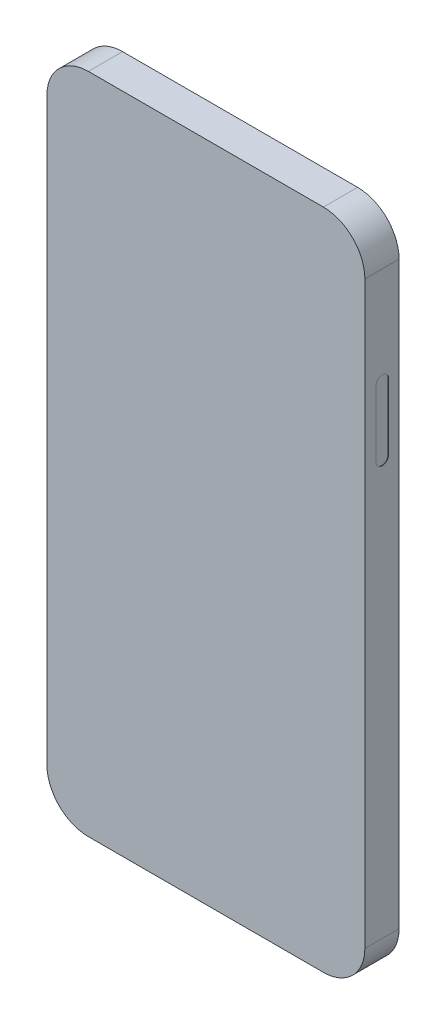
from build123d import *

# Parameters (mm, degrees)
EXTRUDE_1_DEPTH     = 8.25
CUT_EXTRUDE_1_DEPTH = 5
SKETCH_4_R          = 0.5
SKETCH_4_R_2        = 0.517195783
CUT_EXTRUDE_2_DEPTH = 5
CUT_EXTRUDE_3_DEPTH = 0.1
SKETCH_6_R          = 0.157252924
CUT_EXTRUDE_4_DEPTH = 0.1
CUT_EXTRUDE_5_DEPTH = 0.1
CUT_EXTRUDE_6_DEPTH = 0.1
CUT_EXTRUDE_7_DEPTH = 10


with BuildPart() as part:
    # 草图1 → 凸台-拉伸1 (new body)
    with BuildSketch(Plane.XY):
        with BuildLine():
            Line((-18.031435036, 37.379055707), (38.668564964, 37.379055707))
            ThreePointArc((38.668564964, 37.379055707), (45.739632776, 34.450123519), (48.668564964, 27.379055707))
            Line((48.668564964, 27.379055707), (48.668564964, -112.520944293))
            ThreePointArc((48.668564964, -112.520944293), (45.739632776, -119.592012105), (38.668564964, -122.520944293))
            Line((38.668564964, -122.520944293), (-18.031435036, -122.520944293))
            ThreePointArc((-18.031435036, -122.520944293), (-25.102502847, -119.592012105), (-28.031435036, -112.520944293))
            Line((-28.031435036, -112.520944293), (-28.031435036, 27.379055707))
            ThreePointArc((-28.031435036, 27.379055707), (-25.102502847, 34.450123519), (-18.031435036, 37.379055707))
        make_face()
    extrude(amount=EXTRUDE_1_DEPTH)

    # 草图2 → 切除-拉伸1 (cut)
    with BuildSketch(Plane.XZ.offset(122.520944293)):
        with BuildLine():
            Line((6.427510461, 6.234889493), (14.427510461, 6.234889493))
            ThreePointArc((14.427510461, 6.234889493), (15.927510461, 4.734889493), (14.427510461, 3.234889493))
            Line((14.427510461, 3.234889493), (6.427510461, 3.234889493))
            ThreePointArc((6.427510461, 3.234889493), (4.927510461, 4.734889493), (6.427510461, 6.234889493))
        make_face()
    extrude(amount=-CUT_EXTRUDE_1_DEPTH, mode=Mode.SUBTRACT)

    # 草图4 → 切除-拉伸2 (cut)
    with BuildSketch(Plane.XZ.offset(122.520944293)):
        with Locations(Location((2, 4.719775151, 0), (0, 0, 270))):
            Circle(SKETCH_4_R)
        with Locations(Location((0, 4.71977515, 0), (0, 0, 270))):
            Circle(SKETCH_4_R)
        with Locations(Location((-2, 4.71977515, 0), (0, 0, 270))):
            Circle(SKETCH_4_R)
        with Locations(Location((-4, 4.71977515, 0), (0, 0, 270))):
            Circle(SKETCH_4_R)
        with Locations(Location((18, 4.71977515, 0), (0, 0, 270))):
            Circle(SKETCH_4_R_2)
        with Locations(Location((20, 4.71977515, 0), (0, 0, 270))):
            Circle(SKETCH_4_R)
        with Locations(Location((22, 4.71977515, 0), (0, 0, 270))):
            Circle(SKETCH_4_R)
        with Locations(Location((24, 4.71977515, 0), (0, 0, 270))):
            Circle(SKETCH_4_R)
        with Locations(Location((26, 4.71977515, 0), (0, 0, 270))):
            Circle(SKETCH_4_R)
        with Locations(Location((28, 4.71977515, 0), (0, 0, 270))):
            Circle(SKETCH_4_R)
    extrude(amount=-CUT_EXTRUDE_2_DEPTH, mode=Mode.SUBTRACT)

    # 草图5 → 切除-拉伸3 (cut)
    with BuildSketch(Plane(origin=(48.668564964, 0, 0), x_dir=(0, 0, -1), z_dir=(1, 0, 0))):
        with BuildLine():
            Line((-2.555232712, 3.731296592), (-2.555232712, -12.268703408))
            ThreePointArc((-2.555232712, -12.268703408), (-4.055232712, -13.768703408), (-5.555232712, -12.268703408))
            Line((-5.555232712, -12.268703408), (-5.555232712, 3.731296592))
            ThreePointArc((-5.555232712, 3.731296592), (-4.055232712, 5.231296592), (-2.555232712, 3.731296592))
        make_face()
    extrude(amount=-CUT_EXTRUDE_3_DEPTH, mode=Mode.SUBTRACT)

    # 草图6 → 切除-拉伸4 (cut)
    with BuildSketch(Plane.ZY.offset(28.031435036)):
        with Locations(Location((4.361987168, 13.879950774, 0), (0, 0, 270))):
            Circle(SKETCH_6_R)
        with BuildLine():
            Line((5.5, -11.5), (5.5, -22.5))
            ThreePointArc((5.5, -22.5), (4, -24), (2.5, -22.5))
            Line((2.5, -22.5), (2.5, -11.5))
            ThreePointArc((2.5, -11.5), (4, -10), (5.5, -11.5))
        make_face()
        with BuildLine():
            Line((5.5, 5.5), (5.5, -5.5))
            ThreePointArc((5.5, -5.5), (4, -7), (2.5, -5.5))
            Line((2.5, -5.5), (2.5, 5.5))
            ThreePointArc((2.5, 5.5), (4, 7), (5.5, 5.5))
        make_face()
    extrude(amount=-CUT_EXTRUDE_4_DEPTH, mode=Mode.SUBTRACT)

    # 草图9 → 切除-拉伸5 (cut)
    with BuildSketch(Plane.ZY.offset(28.031435036)):
        with BuildLine():
            Line((5.5, 18), (5.5, 12))
            ThreePointArc((5.5, 12), (4, 10.5), (2.5, 12))
            Line((2.5, 12), (2.5, 18))
            ThreePointArc((2.5, 18), (4, 19.5), (5.5, 18))
        make_face()
    extrude(amount=-CUT_EXTRUDE_5_DEPTH, mode=Mode.SUBTRACT)

    # 草图10 → 切除-拉伸6 (cut)
    with BuildSketch(Plane(origin=(0, 0, 0), x_dir=(-1, 0, 0), z_dir=(0, 0, -1))):
        with BuildLine():
            Line((-31.830127614, 25.033557379), (-7.830127614, 25.033557379))
            ThreePointArc((-7.830127614, 25.033557379), (-2.173273364, 22.690411628), (0.169872386, 17.033557379))
            Line((0.169872386, 17.033557379), (0.169872386, -6.966442621))
            ThreePointArc((0.169872386, -6.966442621), (-2.173273364, -12.623296871), (-7.830127614, -14.966442621))
            Line((-7.830127614, -14.966442621), (-31.830127614, -14.966442621))
            ThreePointArc((-31.830127614, -14.966442621), (-37.486981863, -12.623296871), (-39.830127614, -6.966442621))
            Line((-39.830127614, -6.966442621), (-39.830127614, 17.033557379))
            ThreePointArc((-39.830127614, 17.033557379), (-37.486981863, 22.690411628), (-31.830127614, 25.033557379))
        make_face()
    extrude(amount=-CUT_EXTRUDE_6_DEPTH, mode=Mode.SUBTRACT)

    # 草图11 → 切除-拉伸7 (cut)
    with BuildSketch(Plane.ZY.offset(28.031435036)):
        with BuildLine():
            Line((5.5, -40), (5.5, -56))
            ThreePointArc((5.5, -56), (4, -57.5), (2.5, -56))
            Line((2.5, -56), (2.5, -40))
            ThreePointArc((2.5, -40), (4, -38.5), (5.5, -40))
        make_face()
    extrude(amount=-CUT_EXTRUDE_7_DEPTH, mode=Mode.SUBTRACT)


solid = part.part
